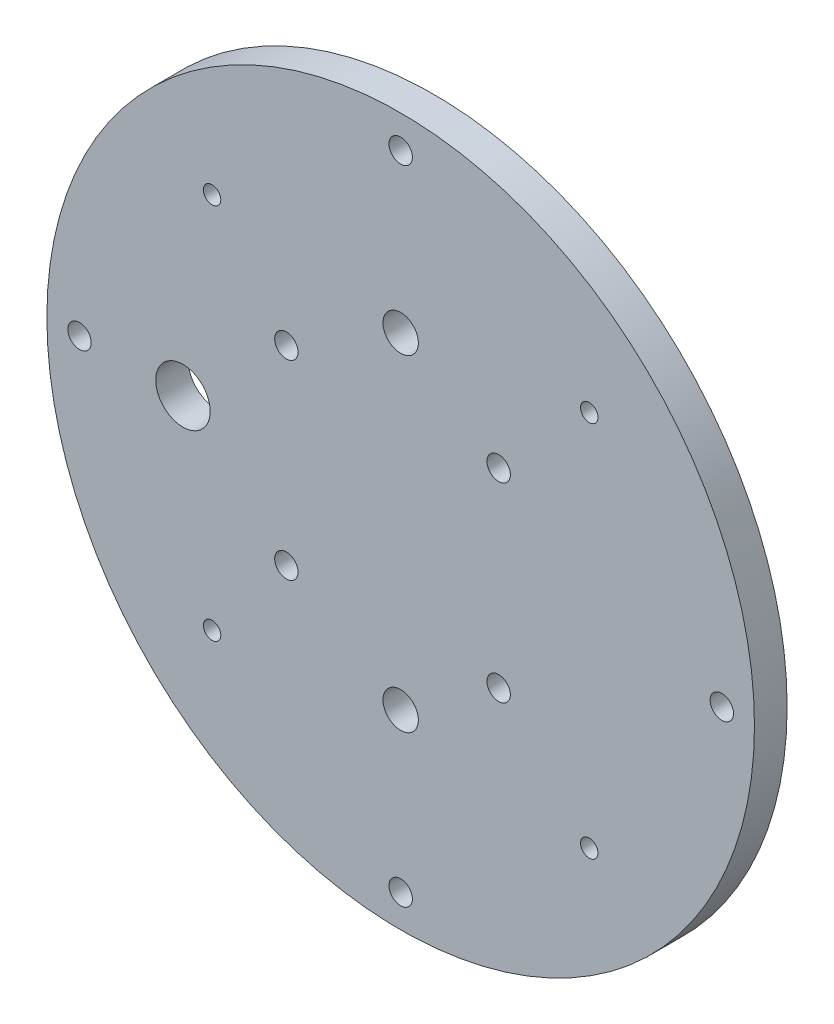
from build123d import *

# Parameters (mm, degrees)
SKETCH_1_R      = 65
SKETCH_1_R_2    = 1.6
SKETCH_1_R_3    = 2.15
SKETCH_1_R_4    = 3.25
SKETCH_1_R_5    = 5
EXTRUDE_1_DEPTH = 6


with BuildPart() as part:
    # 草圖1 → 填料-伸長1 (new body)
    with BuildSketch(Plane.XY):
        Circle(SKETCH_1_R)
        with Locations((34.648232278, 34.648232278)):
            Circle(SKETCH_1_R_2, mode=Mode.SUBTRACT)
        with Locations((-34.648232278, 34.648232278)):
            Circle(SKETCH_1_R_2, mode=Mode.SUBTRACT)
        with Locations((-34.648232278, -34.648232278)):
            Circle(SKETCH_1_R_2, mode=Mode.SUBTRACT)
        with Locations((34.648232278, -34.648232278)):
            Circle(SKETCH_1_R_2, mode=Mode.SUBTRACT)
        with Locations((59, 0)):
            Circle(SKETCH_1_R_3, mode=Mode.SUBTRACT)
        with Locations((0, 59)):
            Circle(SKETCH_1_R_3, mode=Mode.SUBTRACT)
        with Locations((-59, 0)):
            Circle(SKETCH_1_R_3, mode=Mode.SUBTRACT)
        with Locations((0, -59)):
            Circle(SKETCH_1_R_3, mode=Mode.SUBTRACT)
        with Locations((-21, 17.5)):
            Circle(SKETCH_1_R_3, mode=Mode.SUBTRACT)
        with Locations((-21, -17.5)):
            Circle(SKETCH_1_R_3, mode=Mode.SUBTRACT)
        with Locations((18, 17.5)):
            Circle(SKETCH_1_R_3, mode=Mode.SUBTRACT)
        with Locations((18, -17.5)):
            Circle(SKETCH_1_R_3, mode=Mode.SUBTRACT)
        with Locations((0, 30)):
            Circle(SKETCH_1_R_4, mode=Mode.SUBTRACT)
        with Locations((0, -30)):
            Circle(SKETCH_1_R_4, mode=Mode.SUBTRACT)
        with Locations((-40, 0)):
            Circle(SKETCH_1_R_5, mode=Mode.SUBTRACT)
    extrude(amount=EXTRUDE_1_DEPTH)


solid = part.part
